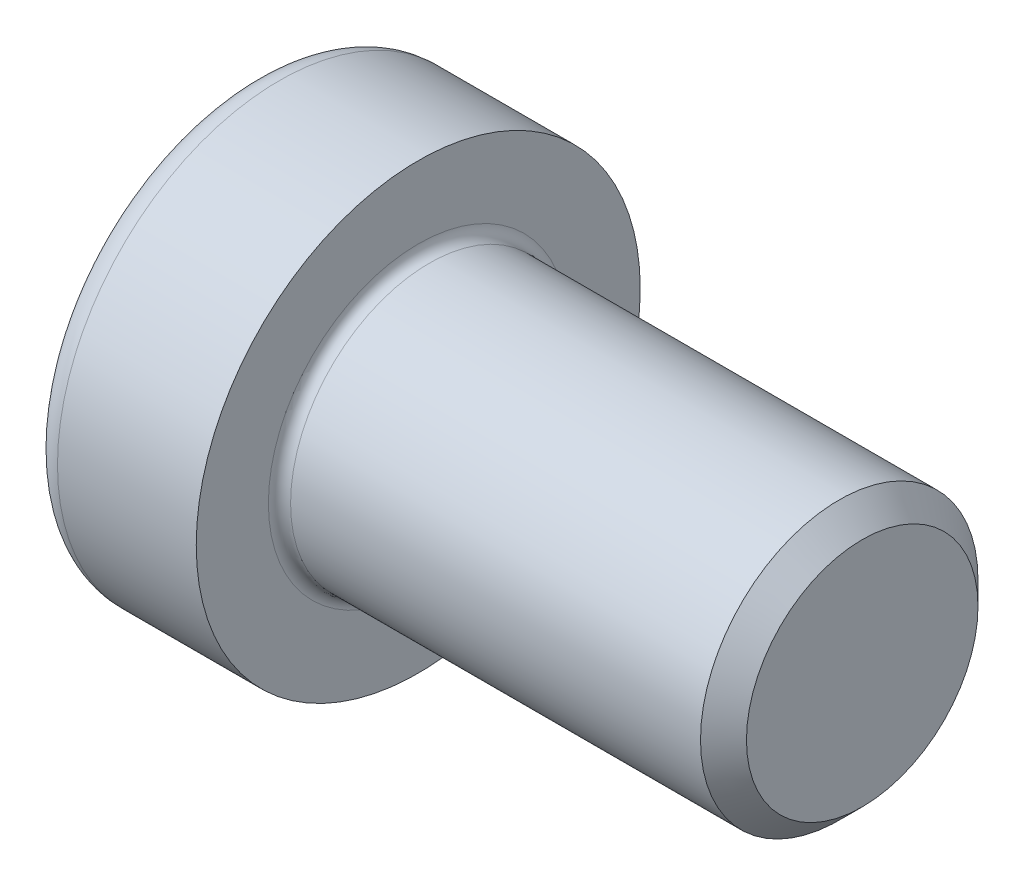
from build123d import *

# Parameters (mm, degrees)
FILLET1_R   = 0.4
FILLET2_R   = 1
HEX_2_DEPTH = 4.5


with BuildPart() as part:
    # BodySke → Base-Revolve (revolve)
    with BuildSketch(Plane.XY, mode=Mode.PRIVATE) as base_revolve_sk:
        Polygon((0, 0), (0, 8), (6, 8), (6, 5), (21.172, 5), (22, 4.172), (22, 0), align=None)
    revolve(base_revolve_sk.sketch.rotate(Axis((-31.75, 0, 0), (1, 0, 0)), 90), axis=Axis((-31.75, 0, 0), (1, 0, 0)))

    # Fillet1
    fillet1_edges = [part.edges().sort_by_distance(p)[0] for p in [
        (6, 0, -5),
    ]]
    fillet(fillet1_edges, radius=FILLET1_R)

    # Fillet2
    fillet2_edges = [part.edges().sort_by_distance(p)[0] for p in [
        (0, 0, -8),
    ]]
    fillet(fillet2_edges, radius=FILLET2_R)

    # Sketch2 → Hex-PreBroach (revolve, cut)
    with BuildSketch(Plane.XY, mode=Mode.PRIVATE) as hex_prebroach_sk:
        Polygon((0, 3.5), (4.5, 3.5), (6.520725942, 0), (0, 0), align=None)
    revolve(hex_prebroach_sk.sketch.rotate(Axis((0, 0, 0), (1, 0, 0)), 90), axis=Axis((0, 0, 0), (1, 0, 0)), mode=Mode.SUBTRACT)

    # Sketch3 → Hex 2 (cut)
    with BuildSketch(Plane(origin=(0, 0, 0), x_dir=(0, 0.500000000000001, 0.866025403784438), z_dir=(-1, 0, 0))):
        Polygon((2.020725942, 3.5), (-2.020725942, 3.5), (-4.041451884, 0), (-2.020725942, -3.5), (2.020725942, -3.5), (4.041451884, 0), align=None)
    extrude(amount=-HEX_2_DEPTH, mode=Mode.SUBTRACT)


solid = part.part
